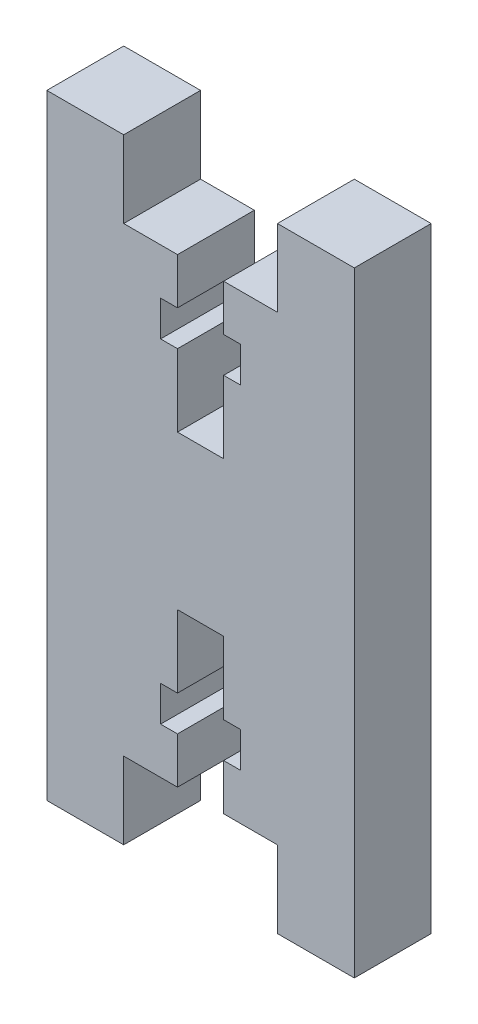
from build123d import *

# Parameters (mm, degrees)
BOSS_EXTRUDE1_DEPTH = 5


with BuildPart() as part:
    # Sketch1 → Boss-Extrude1 (new body)
    with BuildSketch(Plane.XY):
        Polygon((11.5, 30), (15, 30), (15, 35), (20, 35), (20, 0), (20, -5), (15, -5), (15, 0), (11.5, 0), (11.5, 3), (12.6, 3), (12.6, 5.3), (11.5, 5.3), (11.5, 10), (8.5, 10), (8.5, 5.3), (7.4, 5.3), (7.4, 3), (8.5, 3), (8.5, 0), (5, 0), (5, -5), (0, -5), (0, 0), (0, 35), (5, 35), (5, 30), (8.5, 30), (8.5, 27), (7.4, 27), (7.4, 24.7), (8.5, 24.7), (8.5, 20), (11.5, 20), (11.5, 24.7), (12.6, 24.7), (12.6, 27), (11.5, 27), align=None)
    extrude(amount=BOSS_EXTRUDE1_DEPTH)


solid = part.part
